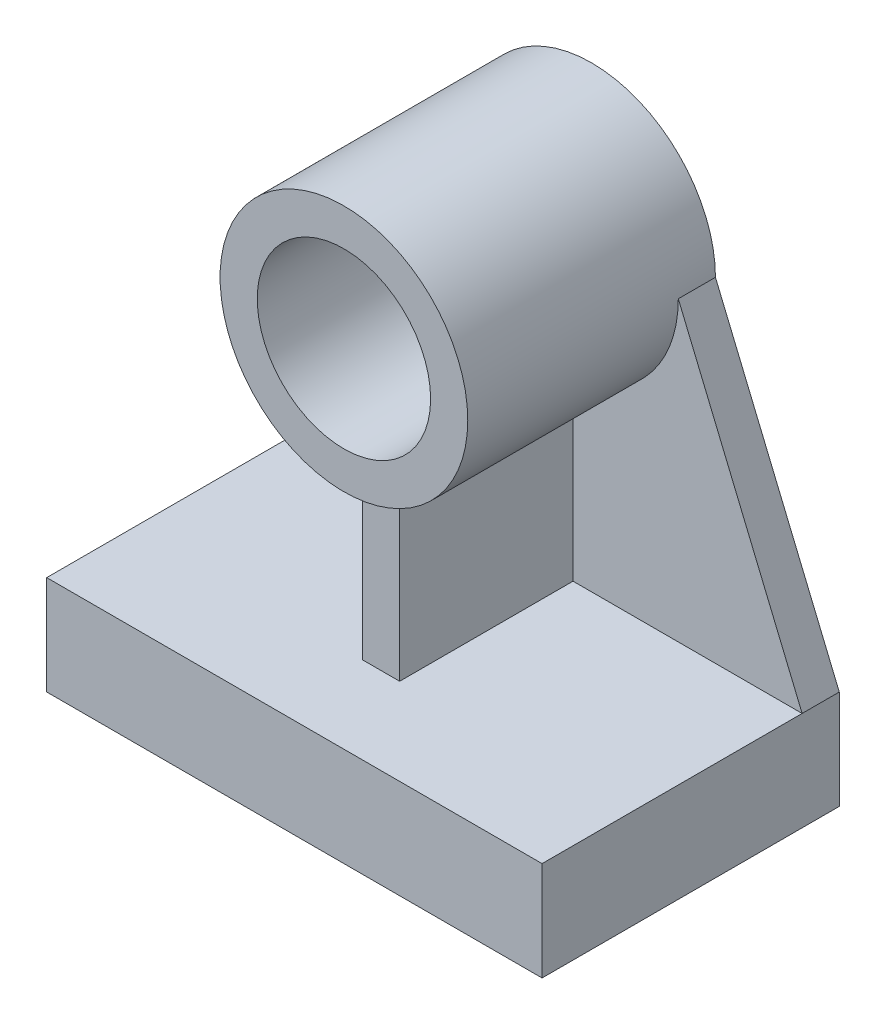
from build123d import *

# Parameters (mm, degrees)
BOSS_EXTRUDE1_DEPTH = 107.95
BOSS_EXTRUDE2_DEPTH = 19.05
SKETCH1_4_R         = 44.45
BOSS_EXTRUDE3_DEPTH = 127
BOSS_EXTRUDE4_DEPTH = 152.4


with BuildPart() as part:
    # Sketch1 → Boss-Extrude1 (new body)
    with BuildSketch(Plane.XY):
        with BuildLine():
            ThreePointArc((9.525, -62.781560788), (0, -63.5), (-9.525, -62.781560788))
            Line((-9.525, -62.781560788), (-9.525, -152.4))
            Line((-9.525, -152.4), (9.525, -152.4))
            Line((9.525, -152.4), (9.525, -62.781560788))
        make_face()
    extrude(amount=BOSS_EXTRUDE1_DEPTH)

    # Sketch1<3> → Boss-Extrude2 (add)
    with BuildSketch(Plane.XY):
        with BuildLine():
            ThreePointArc((-9.525, -62.781560788), (-48.15125907, -41.396935273), (-63.5, 0))
            Line((-63.5, 0), (-127, -152.4))
            Line((-127, -152.4), (-9.525, -152.4))
            Line((-9.525, -152.4), (-9.525, -62.781560788))
        make_face()
        with BuildLine():
            Line((127, -152.4), (63.5, 0))
            ThreePointArc((63.5, 0), (48.15125907, -41.396935273), (9.525, -62.781560788))
            Line((9.525, -62.781560788), (9.525, -152.4))
            Line((9.525, -152.4), (127, -152.4))
        make_face()
    extrude(amount=BOSS_EXTRUDE2_DEPTH)

    # Sketch1<4> → Boss-Extrude3 (add)
    with BuildSketch(Plane.XY):
        with BuildLine():
            ThreePointArc((63.5, 0), (0, 63.5), (-63.5, 0))
            ThreePointArc((-63.5, 0), (-48.15125907, -41.396935273), (-9.525, -62.781560788))
            ThreePointArc((-9.525, -62.781560788), (0, -63.5), (9.525, -62.781560788))
            ThreePointArc((9.525, -62.781560788), (48.15125907, -41.396935273), (63.5, 0))
        make_face()
        Circle(SKETCH1_4_R, mode=Mode.SUBTRACT)
    extrude(amount=BOSS_EXTRUDE3_DEPTH)

    # Sketch1<5> → Boss-Extrude4 (add)
    with BuildSketch(Plane.XY):
        Polygon((-9.525, -152.4), (-127, -152.4), (-127, -203.2), (127, -203.2), (127, -152.4), (9.525, -152.4), align=None)
    extrude(amount=BOSS_EXTRUDE4_DEPTH)


solid = part.part
